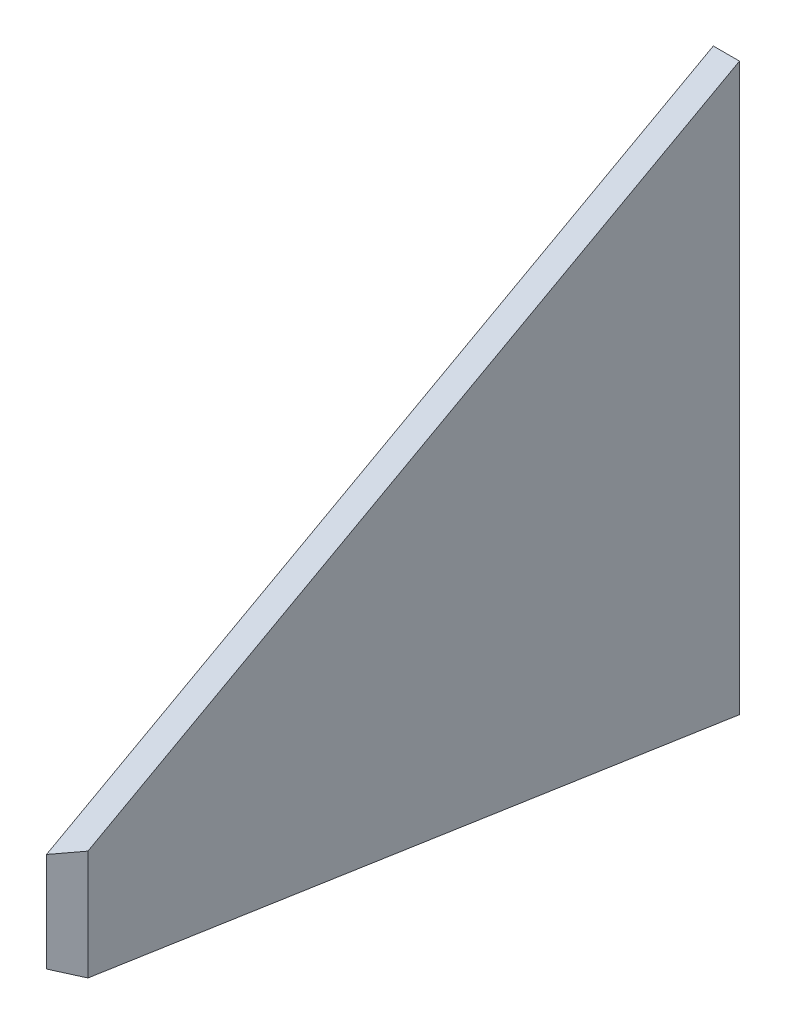
from build123d import *

# Parameters (mm, degrees)
BOSS_EXTRUDE1_DEPTH = 152.4
SKETCH3_OUTSIDE_W   = 273.93
SKETCH3_OUTSIDE_H   = 229.576
CUT_EXTRUDE2_DEPTH  = 381.660734008
SHELL1_T            = -6.35
CUT_EXTRUDE3_DEPTH  = 381.660734008
CUT_EXTRUDE4_DEPTH  = 332.131034202


with BuildPart() as part:
    # Sketch2 → Boss-Extrude1 (new body)
    with BuildSketch(Plane(origin=(0, 0, 0), x_dir=(1, 0, 0), z_dir=(0, 1, 0))):
        Polygon((-57.15, 0), (224.536, 0), (-24.357683353, -196.753899884), align=None)
    extrude(amount=BOSS_EXTRUDE1_DEPTH)

    # Sketch3 outside → Cut-Extrude2 (cut, through all)
    with BuildSketch(Plane(origin=(-63.5, 0, 0), x_dir=(0, 0, -1), z_dir=(1, 0, 0))):
        with Locations((-98.377, 76.2)):
            Rectangle(SKETCH3_OUTSIDE_W, SKETCH3_OUTSIDE_H)
        Polygon((0, 152.4), (-152.4, 107.95), (-261.257142857, 76.2), (-152.4, 44.45), (0, 0), align=None, mode=Mode.SUBTRACT)
    extrude(amount=CUT_EXTRUDE2_DEPTH, mode=Mode.SUBTRACT)

    # Shell1
    shell1_openings = [part.faces().sort_by_distance(p)[0] for p in [
        (83.693, 76.2, 0),
    ]]
    offset(amount=SHELL1_T, openings=shell1_openings, kind=Kind.INTERSECTION)

    # Sketch4 → Cut-Extrude3 (cut, through all)
    with BuildSketch(Plane(origin=(-63.5, 0, 0), x_dir=(0, 0, -1), z_dir=(1, 0, 0))):
        Polygon((0, 152.4), (0, 145.785416667), (-196.753899884, 88.398862534), (-196.753899884, 95.013445867), align=None)
        Polygon((-196.753899884, 64.001137466), (0, 6.614583333), (0, 0), (-196.753899884, 57.386554133), align=None)
    extrude(amount=CUT_EXTRUDE3_DEPTH, mode=Mode.SUBTRACT)

    # Sketch5 → Cut-Extrude4 (cut, through all)
    with BuildSketch(Plane(origin=(0, 149.86, 0), x_dir=(1, 0, 0), z_dir=(0, 1, 0))):
        Polygon((-19.861548271, -185.105168304), (-18.669521453, -192.257329212), (344.317071882, -192.257329212), (317.879717865, 72.864270331), (-35.136715197, 43.31663937), align=None)
    extrude(amount=-CUT_EXTRUDE4_DEPTH, mode=Mode.SUBTRACT)


solid = part.part
